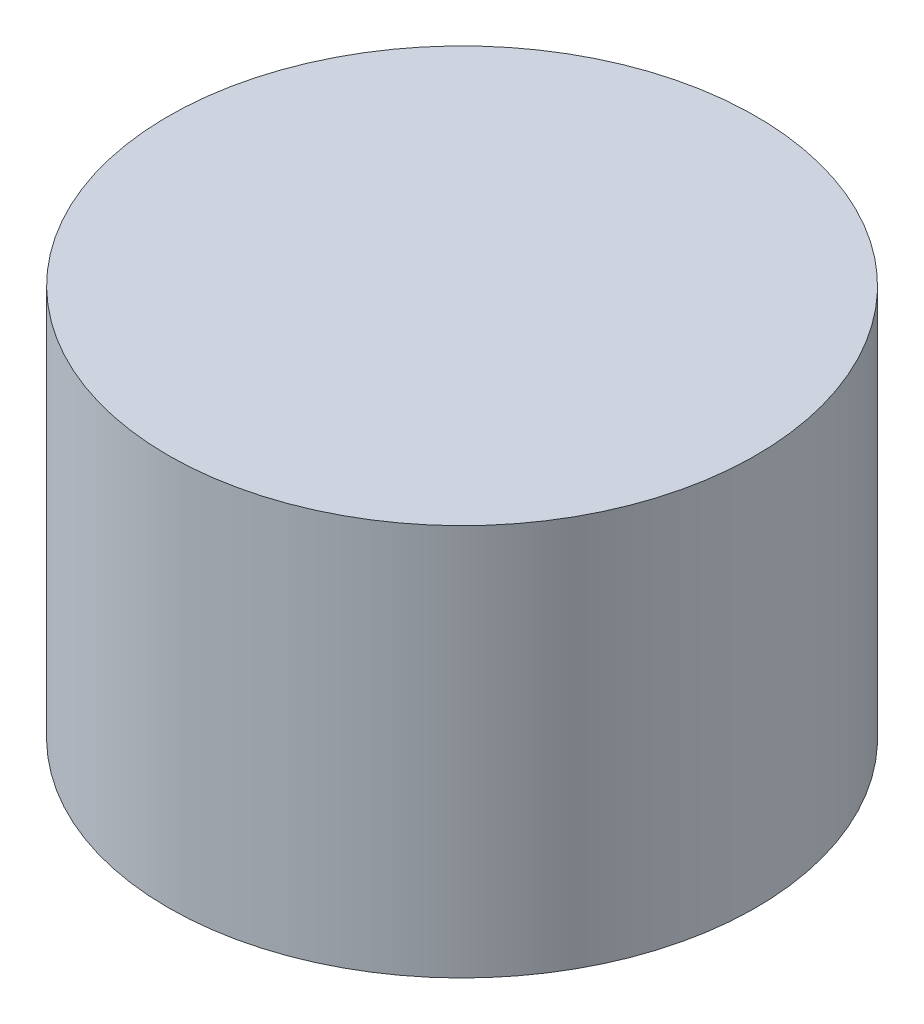
from build123d import *

# Parameters (mm, degrees)
SKETCH1_R           = 76.2
BOSS_EXTRUDE1_DEPTH = 50.8


with BuildPart() as part:
    # Sketch1 → Boss-Extrude1 (new, symmetric)
    with BuildSketch(Plane(origin=(0, 0, 0), x_dir=(1, 0, 0), z_dir=(0, 1, 0))):
        with Locations(Location((0, 0, 0), (0, 0, 270))):
            Circle(SKETCH1_R)
    extrude(amount=BOSS_EXTRUDE1_DEPTH, both=True)


solid = part.part
